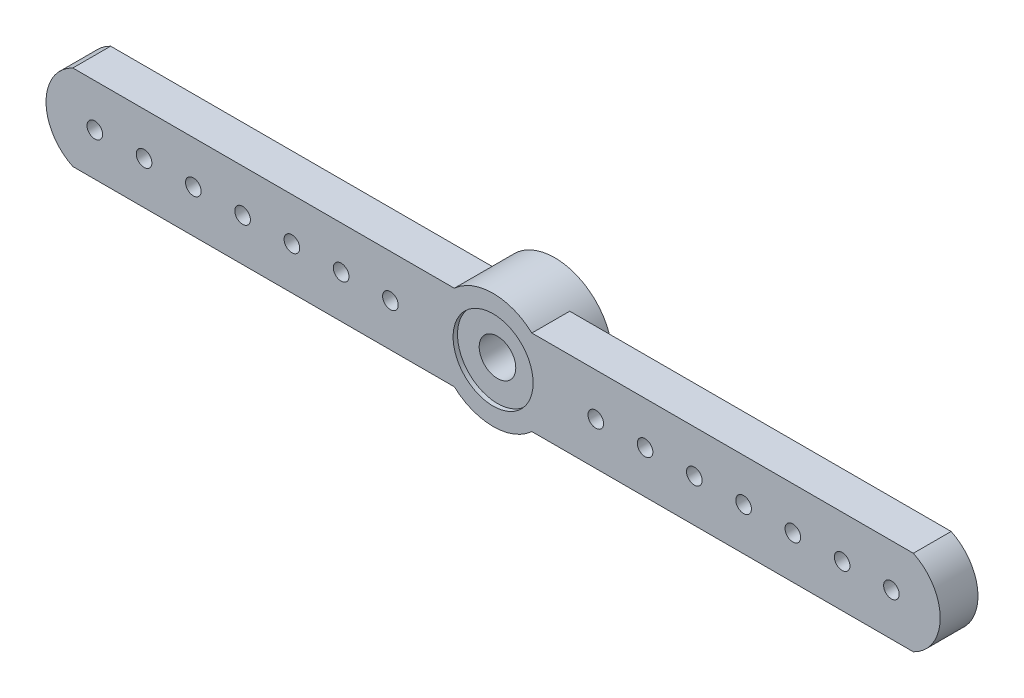
from build123d import *

# Parameters (mm, degrees)
BOSS_EXTRUDE1_DEPTH = 1.9685
SKETCH2_R           = 0.4064
CUT_EXTRUDE1_DEPTH  = 24.55446458
SKETCH3_R           = 2.0828
CUT_EXTRUDE2_DEPTH  = 0.2286
SKETCH4_R           = 0.9525
CUT_EXTRUDE3_DEPTH  = 24.536462381
BOSS_EXTRUDE2_START = 1.2446
SKETCH5_R           = 3.00355
SKETCH5_R_2         = 1.73355
BOSS_EXTRUDE2_DEPTH = 1.2446


with BuildPart() as part:
    # Sketch1 → Boss-Extrude1 (new body)
    with BuildSketch(Plane.XY):
        with BuildLine():
            Line((2.020348077, -2.2225), (-2.020348077, -2.2225))
            ThreePointArc((-2.020348077, -2.2225), (0, -3.00355), (2.020348077, -2.2225))
        make_face()
        with BuildLine():
            Line((2.020348077, 2.2225), (-2.020348077, 2.2225))
            ThreePointArc((-2.020348077, 2.2225), (-3.00355, 0), (-2.020348077, -2.2225))
            Line((-2.020348077, -2.2225), (2.020348077, -2.2225))
            ThreePointArc((2.020348077, -2.2225), (2.746773477, -1.215132942), (3.00355, 0))
            ThreePointArc((3.00355, 0), (2.746773477, 1.215132942), (2.020348077, 2.2225))
        make_face()
        with BuildLine():
            ThreePointArc((2.020348077, 2.2225), (0, 3.00355), (-2.020348077, 2.2225))
            Line((-2.020348077, 2.2225), (2.020348077, 2.2225))
        make_face()
        with BuildLine():
            Line((21.8821, 2.2225), (2.020348077, 2.2225))
            ThreePointArc((2.020348077, 2.2225), (2.746773477, 1.215132942), (3.00355, 0))
            ThreePointArc((3.00355, 0), (2.746773477, -1.215132942), (2.020348077, -2.2225))
            Line((2.020348077, -2.2225), (21.8821, -2.2225))
            ThreePointArc((21.8821, -2.2225), (22.900844734, -1.31254669), (23.2791, 0))
            ThreePointArc((23.2791, 0), (22.900844734, 1.31254669), (21.8821, 2.2225))
        make_face()
        with BuildLine():
            Line((-2.020348077, 2.2225), (-21.8821, 2.2225))
            ThreePointArc((-21.8821, 2.2225), (-22.900844734, 1.31254669), (-23.2791, 0))
            ThreePointArc((-23.2791, 0), (-22.900844734, -1.31254669), (-21.8821, -2.2225))
            Line((-21.8821, -2.2225), (-2.020348077, -2.2225))
            ThreePointArc((-2.020348077, -2.2225), (-3.00355, 0), (-2.020348077, 2.2225))
        make_face()
    extrude(amount=BOSS_EXTRUDE1_DEPTH)

    # Sketch2 → Cut-Extrude1 (cut, through all)
    with BuildSketch(Plane.XY.offset(1.9685)):
        with Locations((-20.7391, 0)):
            Circle(SKETCH2_R)
        with Locations((-18.1737, 0)):
            Circle(SKETCH2_R)
        with Locations((-15.6083, 0)):
            Circle(SKETCH2_R)
        with Locations((-13.0429, 0)):
            Circle(SKETCH2_R)
        with Locations((-10.4775, 0)):
            Circle(SKETCH2_R)
        with Locations((-7.9121, 0)):
            Circle(SKETCH2_R)
        with Locations((-5.3467, 0)):
            Circle(SKETCH2_R)
        with Locations(Location((5.3467, 0, 0), (0, 0, 180))):
            Circle(SKETCH2_R)
        with Locations(Location((7.9121, 0, 0), (0, 0, 180))):
            Circle(SKETCH2_R)
        with Locations(Location((10.4775, 0, 0), (0, 0, 180))):
            Circle(SKETCH2_R)
        with Locations(Location((13.0429, 0, 0), (0, 0, 180))):
            Circle(SKETCH2_R)
        with Locations(Location((15.6083, 0, 0), (0, 0, 180))):
            Circle(SKETCH2_R)
        with Locations(Location((18.1737, 0, 0), (0, 0, 180))):
            Circle(SKETCH2_R)
        with Locations(Location((20.7391, 0, 0), (0, 0, 180))):
            Circle(SKETCH2_R)
    extrude(amount=-CUT_EXTRUDE1_DEPTH, mode=Mode.SUBTRACT)

    # Sketch3 → Cut-Extrude2 (cut)
    with BuildSketch(Plane.XY.offset(1.9685)):
        Circle(SKETCH3_R)
    extrude(amount=-CUT_EXTRUDE2_DEPTH, mode=Mode.SUBTRACT)

    # Sketch4 → Cut-Extrude3 (cut, through all)
    with BuildSketch(Plane.XY.offset(1.7399)):
        Circle(SKETCH4_R)
    extrude(amount=-CUT_EXTRUDE3_DEPTH, mode=Mode.SUBTRACT)

    # Sketch5 → Boss-Extrude2 (add)
    with BuildSketch(Plane(origin=(0, 0, 0), x_dir=(-1, 0, 0), z_dir=(0, 0, -1)).offset(BOSS_EXTRUDE2_START)):
        Circle(SKETCH5_R)
        Circle(SKETCH5_R_2, mode=Mode.SUBTRACT)
    extrude(amount=-BOSS_EXTRUDE2_DEPTH)


solid = part.part
